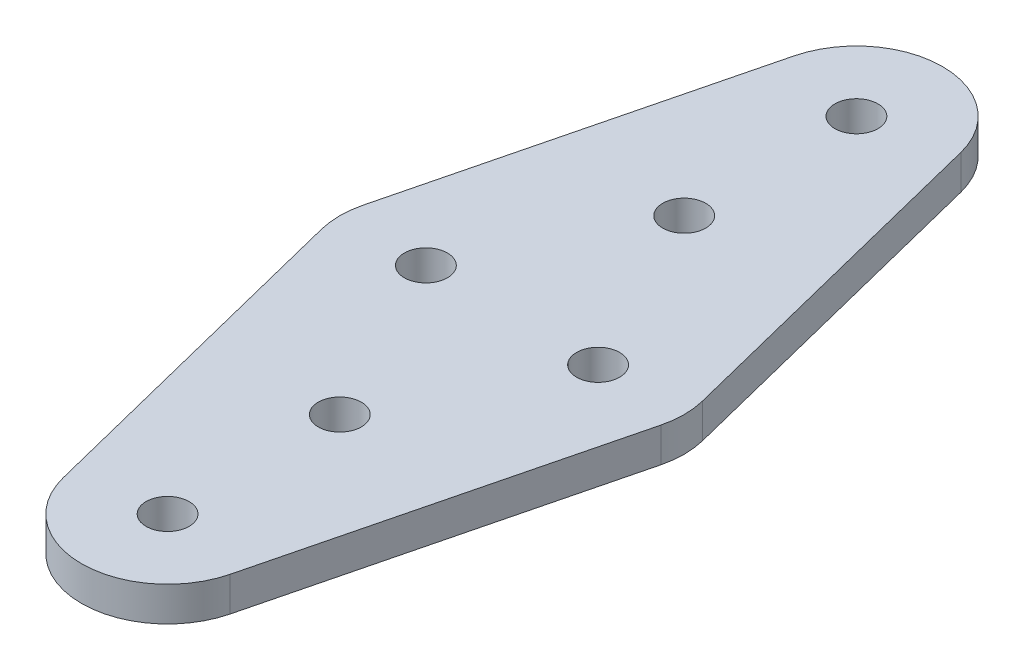
from build123d import *

# Parameters (mm, degrees)
SKETCH1_R           = 2.5
BOSS_EXTRUDE1_DEPTH = 4


with BuildPart() as part:
    # Sketch1 → Boss-Extrude1 (new body)
    with BuildSketch(Plane(origin=(0, 0, 0), x_dir=(1, 0, 0), z_dir=(0, 1, 0))):
        with BuildLine():
            Line((-9.701425001, 42.42535625), (-19.701425001, 2.42535625))
            ThreePointArc((-19.701425001, 2.42535625), (-20, 0), (-19.701425001, -2.42535625))
            Line((-19.701425001, -2.42535625), (-9.701425001, -42.42535625))
            ThreePointArc((-9.701425001, -42.42535625), (0, -50), (9.701425001, -42.42535625))
            Line((9.701425001, -42.42535625), (19.701425001, -2.42535625))
            ThreePointArc((19.701425001, -2.42535625), (20, 0), (19.701425001, 2.42535625))
            Line((19.701425001, 2.42535625), (9.701425001, 42.42535625))
            ThreePointArc((9.701425001, 42.42535625), (0, 50), (-9.701425001, 42.42535625))
        make_face()
        with Locations(Location((10, 0, 0), (0, 0, 270))):
            Circle(SKETCH1_R, mode=Mode.SUBTRACT)
        with Locations(Location((-10, 0, 0), (0, 0, 90))):
            Circle(SKETCH1_R, mode=Mode.SUBTRACT)
        with Locations(Location((0, 20, 0), (0, 0, 270))):
            Circle(SKETCH1_R, mode=Mode.SUBTRACT)
        with Locations(Location((0, 40, 0), (0, 0, 270))):
            Circle(SKETCH1_R, mode=Mode.SUBTRACT)
        with Locations(Location((0, -20, 0), (0, 0, 90))):
            Circle(SKETCH1_R, mode=Mode.SUBTRACT)
        with Locations(Location((0, -40, 0), (0, 0, 90))):
            Circle(SKETCH1_R, mode=Mode.SUBTRACT)
    extrude(amount=BOSS_EXTRUDE1_DEPTH)


solid = part.part
